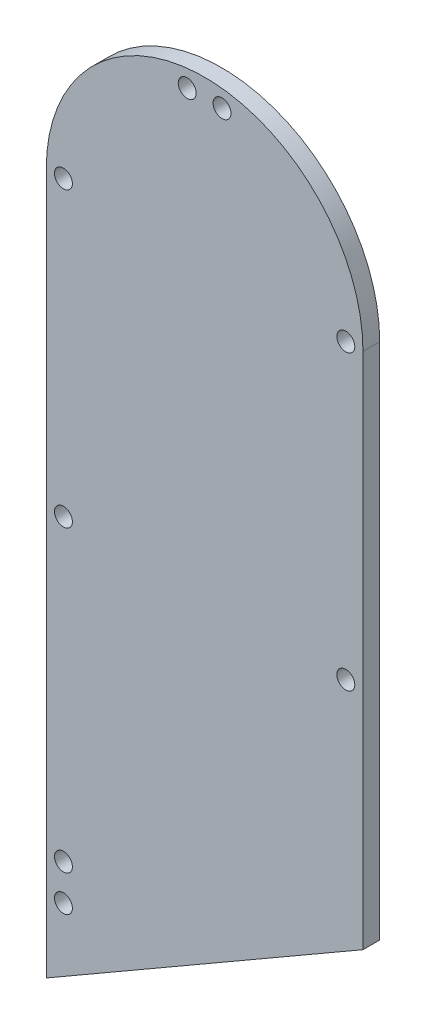
from build123d import *

# Parameters (mm, degrees)
SKETCH2_R           = 1.7
BOSS_EXTRUDE1_DEPTH = 3.175
CUT_EXTRUDE1_DEPTH  = 209.684325946


with BuildPart() as part:
    # Sketch2 → Boss-Extrude1 (new body)
    with BuildSketch(Plane.XY):
        with BuildLine():
            Line((54.582717937, -59.58290593), (54.582717937, 171.394622999))
            ThreePointArc((54.582717937, 171.394622999), (24.582717937, 201.394622999), (-5.417282063, 171.394622999))
            Line((-5.417282063, 171.394622999), (-5.417282063, -59.58290593))
            ThreePointArc((-5.417282063, -59.58290593), (24.582717937, -89.58290593), (54.582717937, -59.58290593))
        make_face()
        with Locations((27.882717937, 197.940291196)):
            Circle(SKETCH2_R, mode=Mode.SUBTRACT)
        with Locations((-2.167282063, -59.58290593)):
            Circle(SKETCH2_R, mode=Mode.SUBTRACT)
        with Locations((5.667611541, -78.498012327)):
            Circle(SKETCH2_R, mode=Mode.SUBTRACT)
        with Locations((21.182717937, -86.115951364)):
            Circle(SKETCH2_R, mode=Mode.SUBTRACT)
        with Locations((51.332717937, 171.394622999)):
            Circle(SKETCH2_R, mode=Mode.SUBTRACT)
        with Locations((-2.167282063, 59.305858535)):
            Circle(SKETCH2_R, mode=Mode.SUBTRACT)
        with Locations((27.982717937, -86.115951364)):
            Circle(SKETCH2_R, mode=Mode.SUBTRACT)
        with Locations((-2.167282063, 171.394622999)):
            Circle(SKETCH2_R, mode=Mode.SUBTRACT)
        with Locations((51.332717937, 115.905858535)):
            Circle(SKETCH2_R, mode=Mode.SUBTRACT)
        with Locations((-2.167282063, 115.905858535)):
            Circle(SKETCH2_R, mode=Mode.SUBTRACT)
        with Locations((43.497824334, -78.498012327)):
            Circle(SKETCH2_R, mode=Mode.SUBTRACT)
        with Locations((51.332717937, -59.58290593)):
            Circle(SKETCH2_R, mode=Mode.SUBTRACT)
        with Locations((51.332717937, -34.094141465)):
            Circle(SKETCH2_R, mode=Mode.SUBTRACT)
        with Locations((-2.167282063, -34.094141465)):
            Circle(SKETCH2_R, mode=Mode.SUBTRACT)
        with Locations((51.332717937, -4.094141465)):
            Circle(SKETCH2_R, mode=Mode.SUBTRACT)
        with Locations((-2.167282063, -4.094141465)):
            Circle(SKETCH2_R, mode=Mode.SUBTRACT)
        with Locations((51.332717937, 25.905858535)):
            Circle(SKETCH2_R, mode=Mode.SUBTRACT)
        with Locations((-2.167282063, 25.905858535)):
            Circle(SKETCH2_R, mode=Mode.SUBTRACT)
        with Locations((21.282717937, 197.940291196)):
            Circle(SKETCH2_R, mode=Mode.SUBTRACT)
        with Locations((51.332717937, 52.505858535)):
            Circle(SKETCH2_R, mode=Mode.SUBTRACT)
        with Locations((51.332717937, 59.305858535)):
            Circle(SKETCH2_R, mode=Mode.SUBTRACT)
        with Locations((-2.167282063, 52.505858535)):
            Circle(SKETCH2_R, mode=Mode.SUBTRACT)
    extrude(amount=BOSS_EXTRUDE1_DEPTH)

    # Sketch3 → Cut-Extrude1 (cut, through all)
    with BuildSketch(Plane.XY.offset(3.175)):
        Polygon((-23.178598576, 28.330849589), (72.344034451, 83.480867481), (72.344034451, -133.046541286), (-23.178598576, -133.046541286), align=None)
    extrude(amount=-CUT_EXTRUDE1_DEPTH, mode=Mode.SUBTRACT)


solid = part.part
